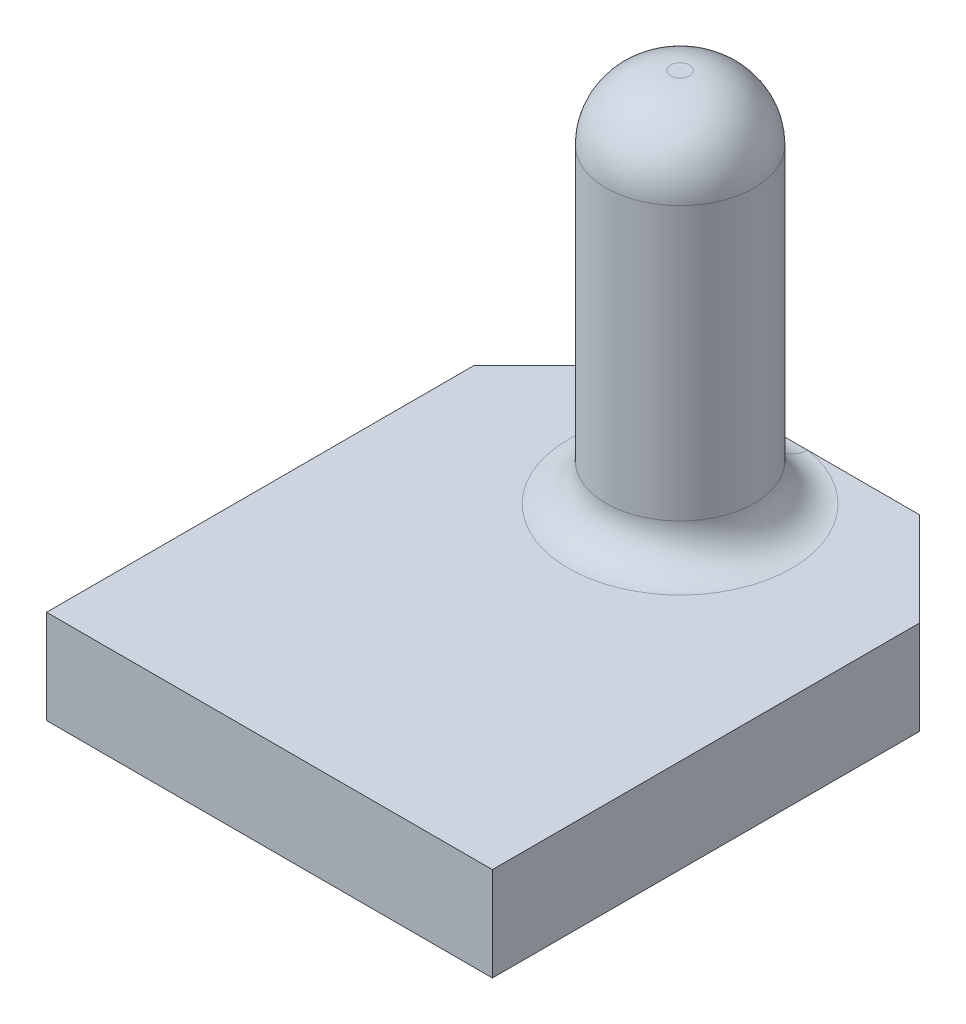
from build123d import *

# Parameters (mm, degrees)
SKETCH1_W           = 23.75
SKETCH1_H           = 27.75
BOSS_EXTRUDE1_DEPTH = 5
SKETCH2_R           = 3.95
BOSS_EXTRUDE2_DEPTH = 20
FILLET1_R           = 3.45
FILLET2_R           = 2
CHAMFER1_SIZE       = 5


with BuildPart() as part:
    # Sketch1 → Boss-Extrude1 (new body)
    with BuildSketch(Plane(origin=(0, 0, 0), x_dir=(1, 0, 0), z_dir=(0, 1, 0))):
        Rectangle(SKETCH1_W, SKETCH1_H)
    extrude(amount=BOSS_EXTRUDE1_DEPTH)

    # Sketch2 → Boss-Extrude2 (add)
    with BuildSketch(Plane(origin=(0, 5, 0), x_dir=(1, 0, 0), z_dir=(0, 1, 0))):
        with Locations(Location((0, 8, 0), (0, 0, 90))):
            Circle(SKETCH2_R)
    extrude(amount=BOSS_EXTRUDE2_DEPTH)

    # Fillet1
    fillet1_edges = [part.edges().sort_by_distance(p)[0] for p in [
        (0, 25, -4.05),
    ]]
    fillet(fillet1_edges, radius=FILLET1_R)

    # Fillet2
    fillet2_edges = [part.edges().sort_by_distance(p)[0] for p in [
        (0, 5, -4.05),
    ]]
    fillet(fillet2_edges, radius=FILLET2_R)

    # Chamfer1
    chamfer1_edges = [part.edges().sort_by_distance(p)[0] for p in [
        (-11.875, 2.5, -13.875),
        (11.875, 2.5, -13.875),
    ]]
    chamfer(chamfer1_edges, length=CHAMFER1_SIZE)


solid = part.part
